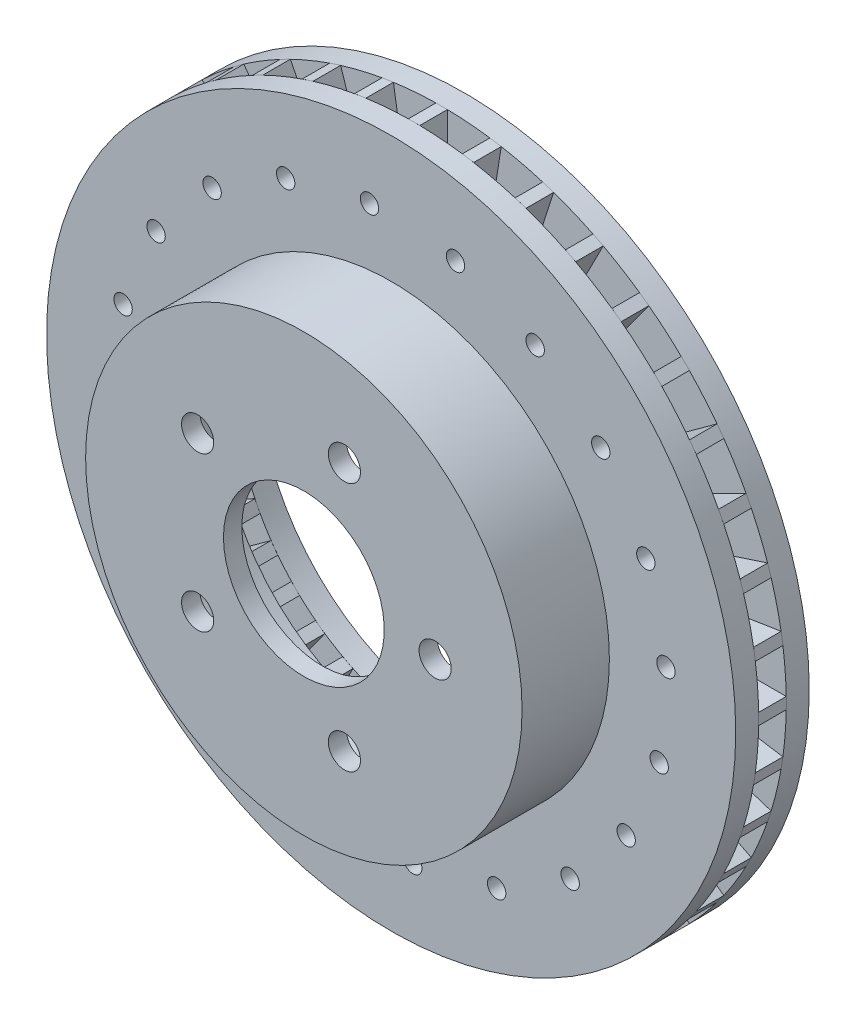
from build123d import *

# Parameters (mm, degrees)
SKETCH_3_R               = 150
SKETCH_3_R_2             = 90
EXTRUDE_2_DEPTH          = 10
SKETCH_4_W               = 60
SKETCH_4_H               = 5
EXTRUDE_3_DEPTH          = 12
PATTERN_CIRCULAR_1_COUNT = 40
SKETCH_5_R               = 150
SKETCH_5_R_2             = 90
EXTRUDE_4_DEPTH          = 10
SKETCH_7_R               = 7
CUT_EXTRUDE_1_DEPTH      = 8
SKETCH_9_R               = 4
CUT_EXTRUDE_4_DEPTH      = 216.50870052


with BuildPart() as part:
    # 草图3 → 凸台-拉伸2 (new body)
    with BuildSketch(Plane.XY):
        Circle(SKETCH_3_R)
        Circle(SKETCH_3_R_2, mode=Mode.SUBTRACT)
    extrude(amount=EXTRUDE_2_DEPTH)

    # 草图4 → 凸台-拉伸3 (add)
    with BuildSketch(Plane.XY.offset(10)):
        with Locations((120, 0)):
            Rectangle(SKETCH_4_W, SKETCH_4_H)
    extrude_3 = extrude(amount=EXTRUDE_3_DEPTH)

    # 阵列(圆周)1: 凸台-拉伸3 ×40 about axis
    pattern_circular_1_axis = Axis((0, 0, 73.5), (0, 0, -1))
    for i in range(1, PATTERN_CIRCULAR_1_COUNT):
        add(extrude_3.rotate(pattern_circular_1_axis, i * 360 / PATTERN_CIRCULAR_1_COUNT))

    # 草图5 → 凸台-拉伸4 (add)
    with BuildSketch(Plane.XY.offset(22)):
        Circle(SKETCH_5_R)
        Circle(SKETCH_5_R_2, mode=Mode.SUBTRACT)
    extrude(amount=EXTRUDE_4_DEPTH)

    # 草图6 → 旋转2 (revolve)
    with BuildSketch(Plane(origin=(0, 0, 0), x_dir=(1, 0, 0), z_dir=(0, 1, 0))):
        Polygon((85, -22), (95, -22), (95, -70), (35, -70), (35, -62), (85, -62), align=None)
    revolve(axis=Axis((0, 0, 0), (0, 0, 1)))

    # 草图7 → 切除-拉伸1 (cut)
    with BuildSketch(Plane.XY.offset(70)):
        with Locations((57.15, 0)):
            Circle(SKETCH_7_R)
        with Locations((17.660321, 54.35288)):
            Circle(SKETCH_7_R)
        with Locations((-46.235321, 33.591927)):
            Circle(SKETCH_7_R)
        with Locations((-46.235321, -33.591927)):
            Circle(SKETCH_7_R)
        with Locations((17.660321, -54.35288)):
            Circle(SKETCH_7_R)
    extrude(amount=-CUT_EXTRUDE_1_DEPTH, mode=Mode.SUBTRACT)

    # 草图9 → 切除-拉伸4 (cut, through all)
    with BuildSketch(Plane.XY.offset(32)):
        with Locations((119.63008, 9.415091)):
            Circle(SKETCH_9_R)
        with Locations((110.865544, 45.922012)):
            Circle(SKETCH_9_R)
        with Locations((91.248716, 77.933766)):
            Circle(SKETCH_9_R)
        with Locations((62.699828, 102.31682)):
            Circle(SKETCH_9_R)
        with Locations((28.013444, 116.68439)):
            Circle(SKETCH_9_R)
        with Locations((-9.415091, 119.63008)):
            Circle(SKETCH_9_R)
        with Locations((-45.922012, 110.865544)):
            Circle(SKETCH_9_R)
        with Locations((-77.933766, 91.248716)):
            Circle(SKETCH_9_R)
        with Locations((-102.31682, 62.699828)):
            Circle(SKETCH_9_R)
        with Locations((-116.68439, 28.013444)):
            Circle(SKETCH_9_R)
        with Locations((-119.63008, -9.415091)):
            Circle(SKETCH_9_R)
        with Locations((-110.865544, -45.922012)):
            Circle(SKETCH_9_R)
        with Locations((-91.248716, -77.933766)):
            Circle(SKETCH_9_R)
        with Locations((-62.699828, -102.31682)):
            Circle(SKETCH_9_R)
        with Locations((-28.013444, -116.68439)):
            Circle(SKETCH_9_R)
        with Locations((9.415091, -119.63008)):
            Circle(SKETCH_9_R)
        with Locations((45.922012, -110.865544)):
            Circle(SKETCH_9_R)
        with Locations((77.933766, -91.248716)):
            Circle(SKETCH_9_R)
        with Locations((102.31682, -62.699828)):
            Circle(SKETCH_9_R)
        with Locations((116.68439, -28.013444)):
            Circle(SKETCH_9_R)
    extrude(amount=-CUT_EXTRUDE_4_DEPTH, mode=Mode.SUBTRACT)


solid = part.part
